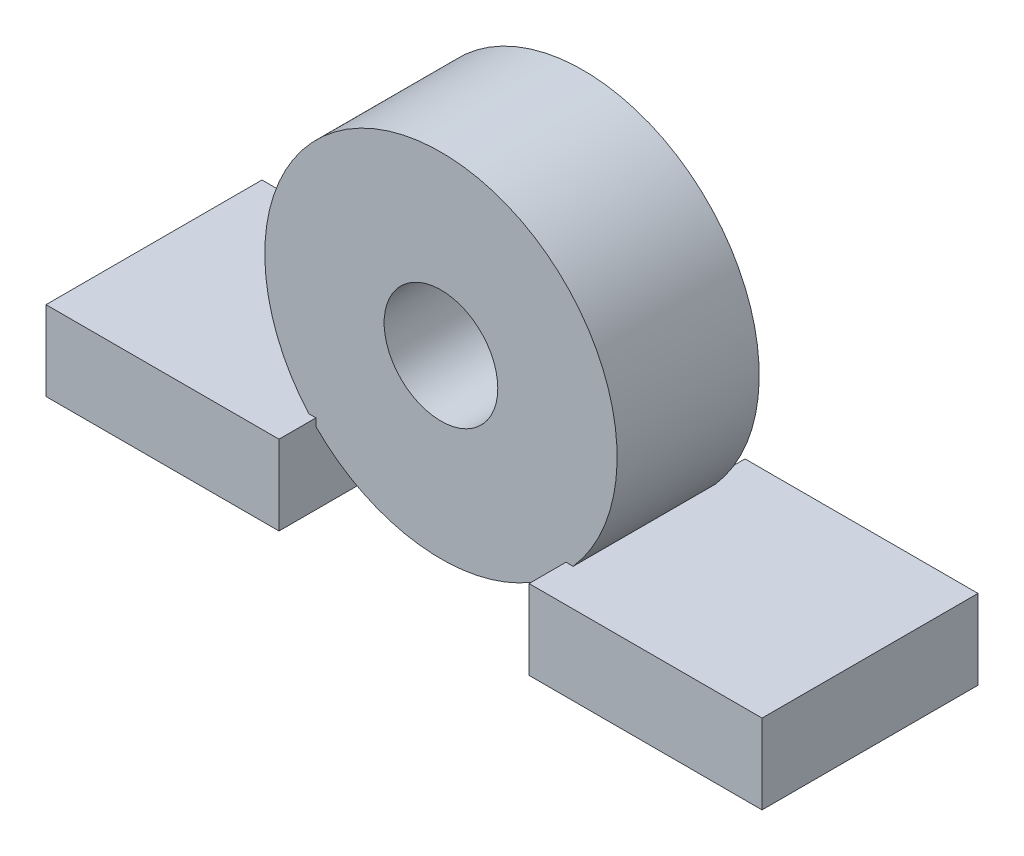
from build123d import *

# Parameters (mm, degrees)
SKETCH_13_W           = 41
SKETCH_13_H           = 38
BOSS_EXTRUDE1_DEPTH   = 14
BOSS_EXTRUDE1_2_DEPTH = 14
SKETCH1_R             = 31
SKETCH1_R_2           = 10
BOSS_EXTRUDE2_DEPTH   = 25


with BuildPart() as part:
    # Эскиз13 → Boss-Extrude1 (new body)
    with BuildSketch(Plane(origin=(0, -36, 0), x_dir=(-1, 0, 0), z_dir=(0, 1, 0))):
        with Locations((-7.5, 17.5)):
            Rectangle(SKETCH_13_W, SKETCH_13_H)
    extrude(amount=BOSS_EXTRUDE1_DEPTH)



with BuildPart() as body_2:
    # Эскиз13 → Boss-Extrude1 2 (new body)
    with BuildSketch(Plane(origin=(0, -36, 0), x_dir=(-1, 0, 0), z_dir=(0, 1, 0))):
        with Locations((-92.5, 17.5)):
            Rectangle(SKETCH_13_W, SKETCH_13_H)
    extrude(amount=BOSS_EXTRUDE1_2_DEPTH)


with BuildPart() as part_1:
    add(part.part)

    add(body_2.part)  # Boss-Extrude2 merges body 2
    # Sketch1 → Boss-Extrude2 (add)
    with BuildSketch(Plane.XY.offset(5)):
        with Locations((50, -1.5)):
            Circle(SKETCH1_R)
        with Locations((50, -1.5)):
            Circle(SKETCH1_R_2, mode=Mode.SUBTRACT)
    extrude(amount=BOSS_EXTRUDE2_DEPTH)


solid = part_1.part
